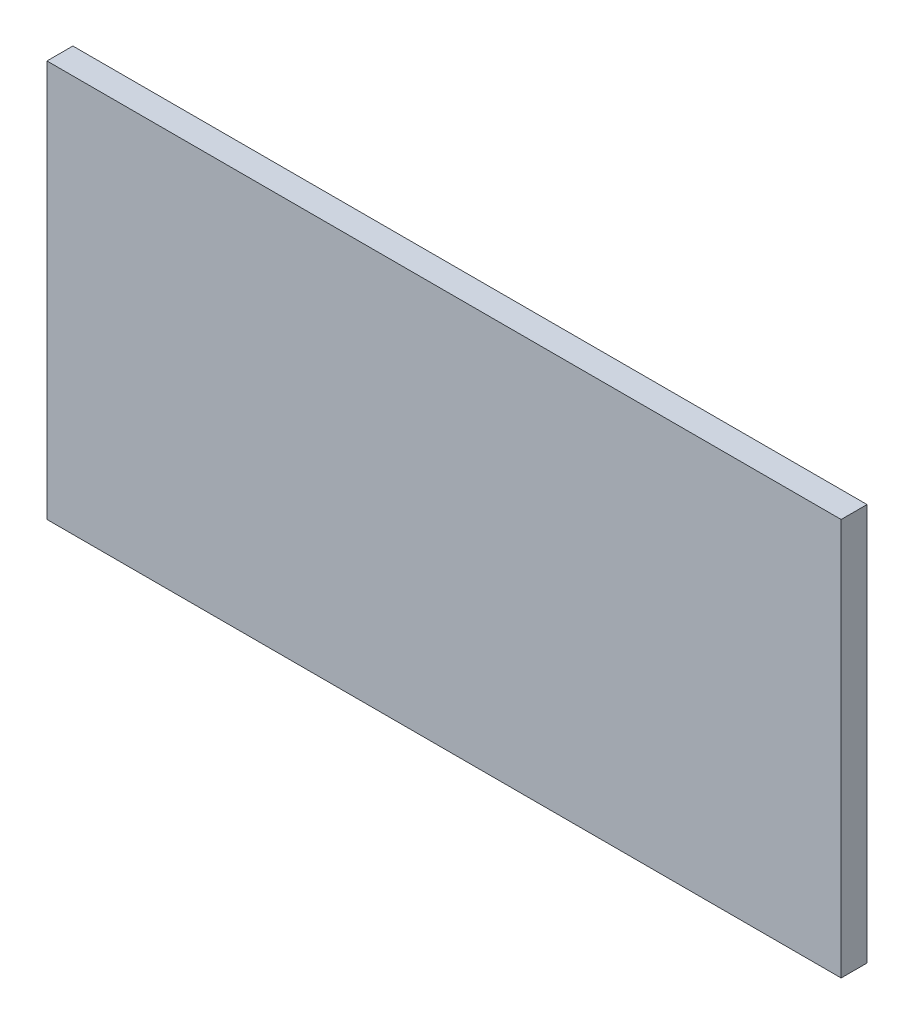
from build123d import *

# Parameters (mm, degrees)
SKETCH1_W           = 92
SKETCH1_H           = 46
BOSS_EXTRUDE1_DEPTH = 3


with BuildPart() as part:
    # Sketch1 → Boss-Extrude1 (new body)
    with BuildSketch(Plane.XY):
        Rectangle(SKETCH1_W, SKETCH1_H)
    extrude(amount=BOSS_EXTRUDE1_DEPTH)


solid = part.part
